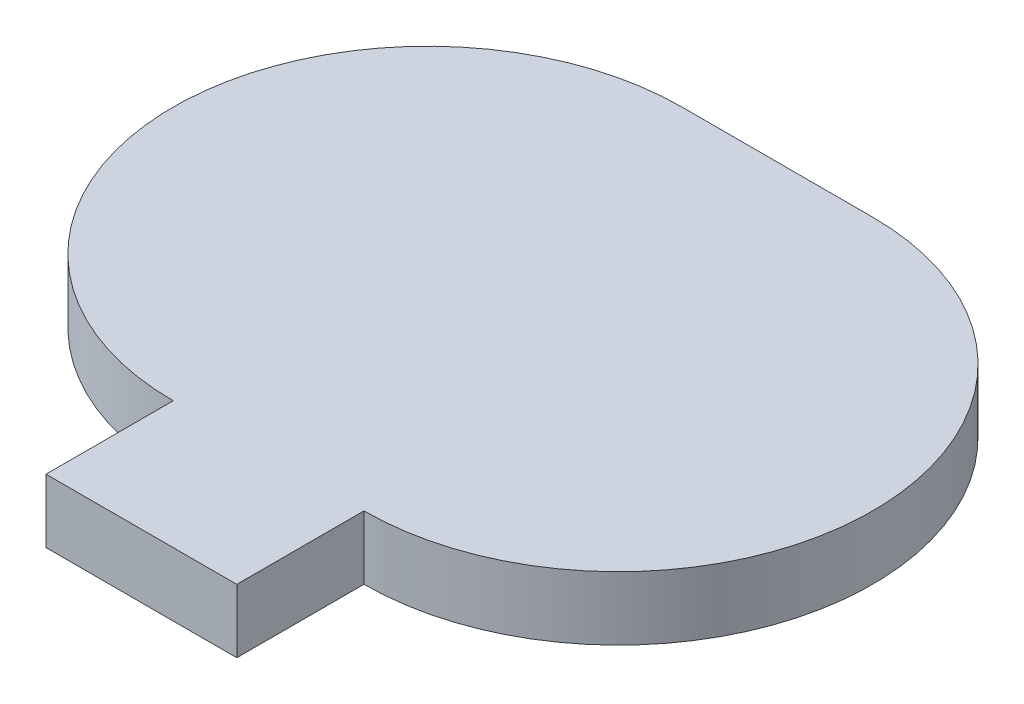
from build123d import *

# Parameters (mm, degrees)
BOSS_EXTRUDE1_DEPTH = 2


with BuildPart() as part:
    # Sketch1 → Boss-Extrude1 (new body)
    with BuildSketch(Plane(origin=(0, 0, 0), x_dir=(1, 0, 0), z_dir=(0, 1, 0))):
        with BuildLine():
            Line((-3, 4), (-3, 0))
            Line((-3, 0), (3, 0))
            Line((3, 0), (3, 4))
            ThreePointArc((3, 4), (11, 12), (3, 20))
            Line((3, 20), (-3, 20))
            ThreePointArc((-3, 20), (-11, 12), (-3, 4))
        make_face()
    extrude(amount=BOSS_EXTRUDE1_DEPTH)


solid = part.part
